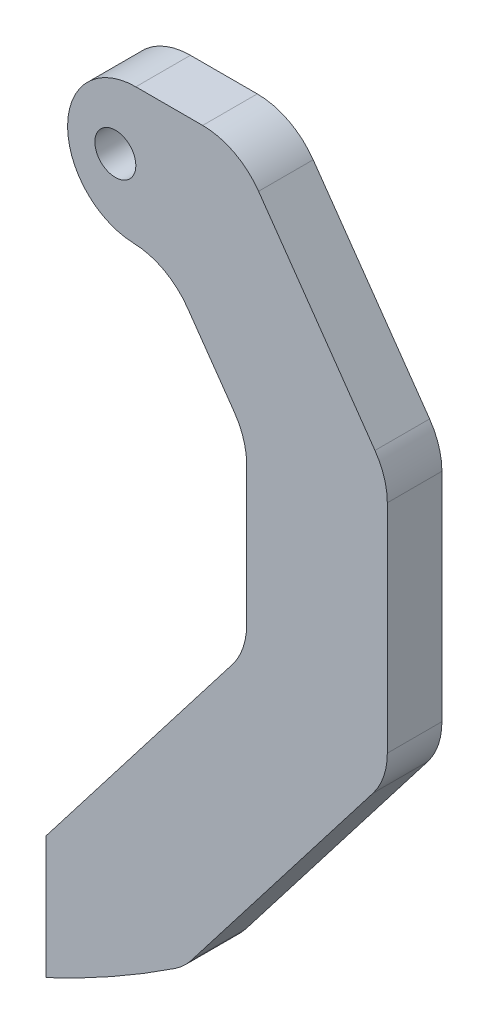
from build123d import *

# Parameters (mm, degrees)
SKETCH1_R           = 3
BOSS_EXTRUDE1_DEPTH = 8
FILLET1_R           = 10
FILLET2_R           = 10


with BuildPart() as part:
    # Sketch1 → Boss-Extrude1 (new body)
    with BuildSketch(Plane.XY):
        with BuildLine():
            Line((10.147551644, -27.873187436), (35.147551644, -27.873187436))
            Line((35.147551644, -27.873187436), (56.997626327, -59.078328042))
            Line((56.997626327, -59.078328042), (56.997626327, -97.413556574))
            Line((56.997626327, -97.413556574), (27.269645082, -135.957207253))
            ThreePointArc((27.269645082, -135.957207253), (17.360823002, -142.124386911), (6.997626327, -147.49309389))
            Line((6.997626327, -147.49309389), (6.997626327, -129.49309389))
            Line((6.997626327, -129.49309389), (36.388859372, -91.386052238))
            Line((36.388859372, -91.386052238), (36.388859372, -64.514894506))
            Line((36.388859372, -64.514894506), (24.736210633, -47.873187436))
            Line((24.736210633, -47.873187436), (10.147551644, -47.873187436))
            Line((10.147551644, -47.873187436), (10.147551644, -27.873187436))
        make_face()
        with Locations((17.147551644, -37.873187436)):
            Circle(SKETCH1_R, mode=Mode.SUBTRACT)
    extrude(amount=BOSS_EXTRUDE1_DEPTH)

    # Fillet1
    fillet1_edges = [part.edges().sort_by_distance(p)[0] for p in [
        (36.388859372, -64.514894506, 4),
        (24.736210633, -47.873187436, 4),
        (35.147551644, -27.873187436, 4),
        (56.997626327, -59.078328042, 4),
        (56.997626327, -97.413556574, 4),
        (27.269645082, -135.957207253, 4),
        (36.388859372, -91.386052238, 4),
    ]]
    fillet(fillet1_edges, radius=FILLET1_R)

    # Fillet2
    fillet2_edges = [part.edges().sort_by_distance(p)[0] for p in [
        (10.147551644, -27.873187436, 4),
        (10.147551644, -47.873187436, 4),
    ]]
    fillet(fillet2_edges, radius=FILLET2_R)


solid = part.part
